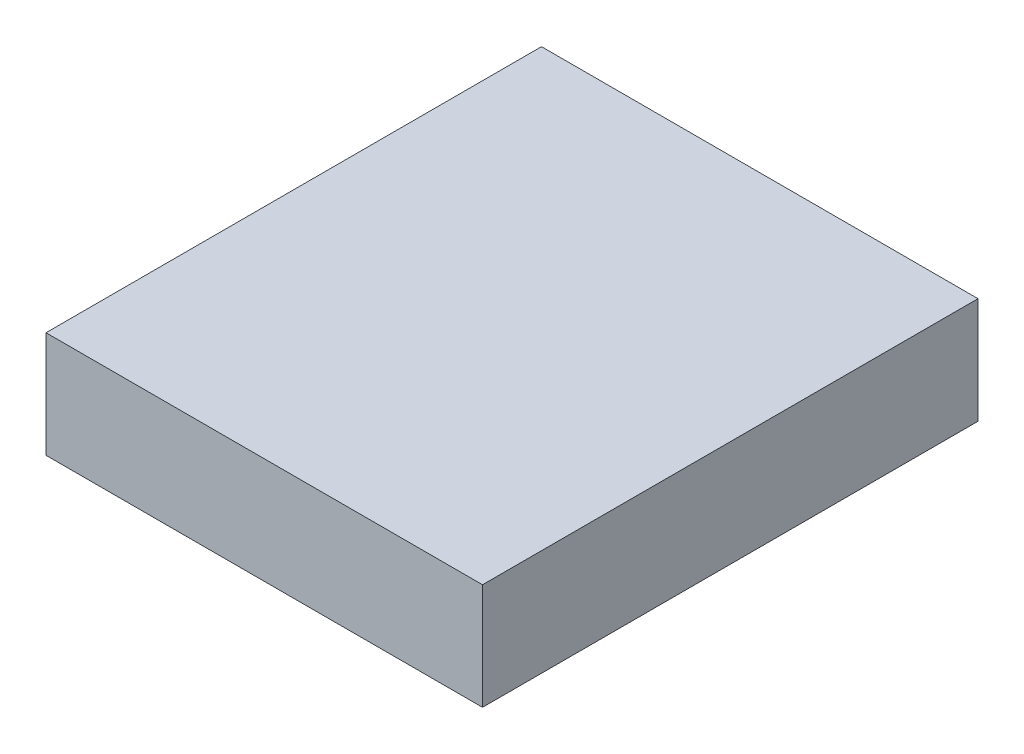
from build123d import *

# Parameters (mm, degrees)
SKETCH1_W           = 37
SKETCH1_H           = 42
BOSS_EXTRUDE1_DEPTH = 9


with BuildPart() as part:
    # Sketch1 → Boss-Extrude1 (new body)
    with BuildSketch(Plane(origin=(0, 0, 0), x_dir=(1, 0, 0), z_dir=(0, 1, 0))):
        Rectangle(SKETCH1_W, SKETCH1_H)
    extrude(amount=BOSS_EXTRUDE1_DEPTH)


solid = part.part
